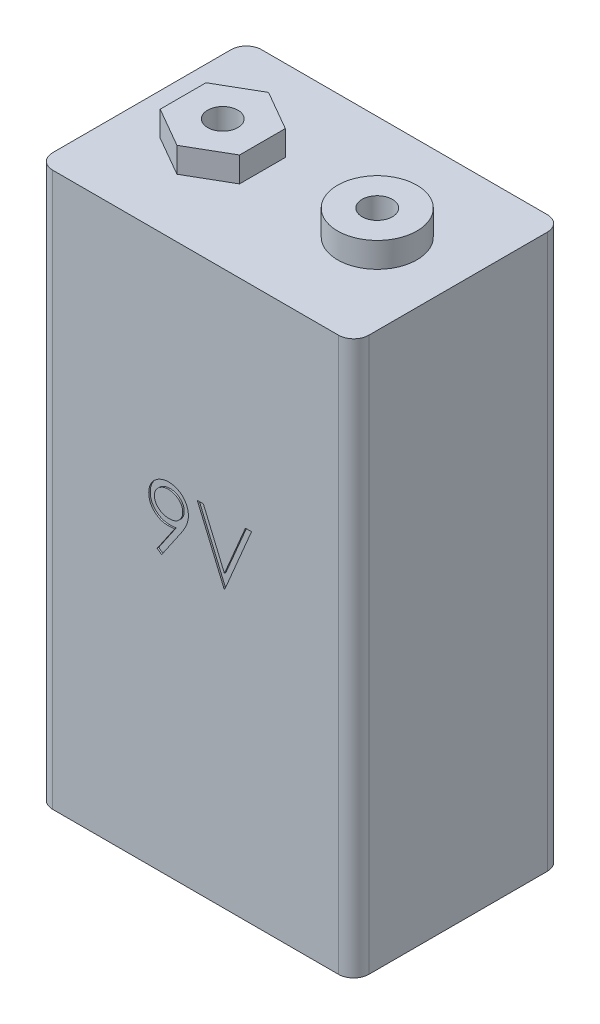
from build123d import *

# Parameters (mm, degrees)
SKETCH1_W           = 26.5
SKETCH1_H           = 46.4
BOSS_EXTRUDE1_DEPTH = 8.75
SKETCH2_R           = 3.325
SKETCH2_R_2         = 1.27
BOSS_EXTRUDE2_DEPTH = 2.1
CUT_EXTRUDE1_DEPTH  = 0.127
FILLET1_R           = 1.27


with BuildPart() as part:
    # Sketch1 → Boss-Extrude1 (new, symmetric)
    with BuildSketch(Plane.XY):
        Rectangle(SKETCH1_W, SKETCH1_H)
    extrude(amount=BOSS_EXTRUDE1_DEPTH, both=True)

    # Sketch2 → Boss-Extrude2 (add)
    # profile 1 of 2: a face of its own
    with BuildSketch(Plane(origin=(0, 23.2, 0), x_dir=(1, 0, 0), z_dir=(0, 1, 0))):
        with Locations(Location((6.475, 0, 0), (0, 0, 90))):
            Circle(SKETCH2_R)
        with Locations(Location((6.475, 0, 0), (0, 0, 270))):
            Circle(SKETCH2_R_2, mode=Mode.SUBTRACT)
    # profile 2 of 2: a face of its own
    with BuildSketch(Plane(origin=(0, 23.2, 0), x_dir=(1, 0, 0), z_dir=(0, 1, 0))):
        Polygon((-6.475, 3.83937929), (-9.8, 1.919689645), (-9.8, -1.919689645), (-6.475, -3.83937929), (-3.15, -1.919689645), (-3.15, 1.919689645), align=None)
        with Locations(Location((-6.475, 0, 0), (0, 0, 270))):
            Circle(SKETCH2_R_2, mode=Mode.SUBTRACT)
    extrude(amount=BOSS_EXTRUDE2_DEPTH)

    # Sketch3 → Cut-Extrude1 (cut)
    # profile 1 of 2: a face of its own
    with BuildSketch(Plane.XY.offset(8.75)):
        with BuildLine():
            Line((-2.843132665, -0.135683761), (-3.222623183, 0.128263555))
            Line((-3.222623183, 0.128263555), (-1.751302403, 2.279063168))
            add(Edge.make_bspline(
                [(-1.751302403, 2.279063168), (-1.845177682, 2.267583179), (-2.03002334, 2.244978442), (-2.216194911, 2.240825761), (-2.307817828, 2.238782051)],
                knots=[0, 0, 0, 0, 1.015715272, 2, 2, 2, 2], degree=3))
            add(Edge.make_bspline(
                [(-2.307817828, 2.238782051), (-2.363368305, 2.240204869), (-2.472409033, 2.242997737), (-2.632718794, 2.265134756), (-2.786760058, 2.299228402), (-2.934124441, 2.350102115), (-3.075365836, 2.413327264), (-3.210175902, 2.49173013), (-3.338373165, 2.583965833), (-3.458580797, 2.689546665), (-3.567909259, 2.805476578), (-3.66531115, 2.928176181), (-3.746260242, 3.059070803), (-3.813504604, 3.195490302), (-3.864501837, 3.339395439), (-3.901638055, 3.489148699), (-3.924501614, 3.645799634), (-3.927221675, 3.752426915), (-3.92860275, 3.806565505)],
                knots=[0, 0, 0, 0, 1.060718605, 2.082097864, 3.085795603, 4.069760067, 5.054557537, 6.03741023, 7.043284206, 8.066802108, 9.088538119, 10.083643548, 11.053783639, 12.022749082, 12.983451788, 13.964007469, 14.966251758, 16, 16, 16, 16], degree=3))
            add(Edge.make_bspline(
                [(-3.92860275, 3.806565505), (-3.92598045, 3.880601444), (-3.920833407, 4.025918974), (-3.879409458, 4.238241458), (-3.811282517, 4.439002066), (-3.716291995, 4.627672954), (-3.596647832, 4.801540095), (-3.452852702, 4.958186445), (-3.285781232, 5.095384022), (-3.09923937, 5.213318758), (-2.897622303, 5.308168099), (-2.686456594, 5.378077517), (-2.467360245, 5.419199434), (-2.318940077, 5.424620914), (-2.244216065, 5.427350427)],
                knots=[0, 0, 0, 0, 1.022988612, 2.007919123, 2.978103895, 3.94594894, 4.918897164, 5.887013414, 6.875921846, 7.89917871, 8.930658928, 9.948724884, 10.967259574, 12, 12, 12, 12], degree=3))
            add(Edge.make_bspline(
                [(-2.244216065, 5.427350427), (-2.170906192, 5.424583395), (-2.026052794, 5.419116), (-1.813042034, 5.379074761), (-1.609024068, 5.311588363), (-1.415129862, 5.218327177), (-1.235607179, 5.101425329), (-1.074172322, 4.962126704), (-0.934509305, 4.800344538), (-0.816847009, 4.619991701), (-0.722398257, 4.426215432), (-0.654253258, 4.223946883), (-0.612304494, 4.014640721), (-0.607018381, 3.872832409), (-0.604350614, 3.801265358)],
                knots=[0, 0, 0, 0, 1.026385292, 2.028040595, 3.023318987, 4.028184125, 5.03290303, 6.015178782, 7.004435299, 8.016004309, 9.023023918, 10.015172535, 10.998308025, 12, 12, 12, 12], degree=3))
            add(Edge.make_bspline(
                [(-0.604350614, 3.801265358), (-0.606132256, 3.745712281), (-0.609745871, 3.633036762), (-0.635049573, 3.461843267), (-0.678018187, 3.287292003), (-0.726779683, 3.139546257), (-0.773848556, 3.017522768), (-0.818149077, 2.921136451), (-0.867304356, 2.819685731), (-0.924633918, 2.714234399), (-0.986262629, 2.603438185), (-1.055899868, 2.488408365), (-1.131957102, 2.368990578), (-1.186128226, 2.288486052), (-1.213867507, 2.247262286)],
                knots=[0, 0, 0, 0, 1.179839688, 2.393009684, 3.667231171, 4.993948276, 5.694988576, 6.444077775, 7.246288328, 8.089075292, 8.993003841, 9.939041771, 10.944649915, 12, 12, 12, 12], degree=3))
            Line((-1.213867507, 2.247262286), (-2.843132665, -0.135683761))
        make_face()
        with BuildLine():
            add(Edge.make_bspline(
                [(-2.219835389, 2.781517094), (-2.177753011, 2.782666722), (-2.095832926, 2.784904656), (-1.97582201, 2.798525772), (-1.86254375, 2.822676918), (-1.755695551, 2.85732934), (-1.654206069, 2.899143589), (-1.559687334, 2.952380758), (-1.472060244, 3.015905909), (-1.390738021, 3.087282956), (-1.318523403, 3.166583243), (-1.254202392, 3.24958244), (-1.199531058, 3.336644886), (-1.156346103, 3.42886089), (-1.120839662, 3.523985717), (-1.096319572, 3.62355123), (-1.082736116, 3.727038693), (-1.080420521, 3.797340236), (-1.079243776, 3.833066239)],
                knots=[0, 0, 0, 0, 1.163407946, 2.26475976, 3.333800367, 4.359385343, 5.366239384, 6.363380779, 7.350133999, 8.353570782, 9.349036268, 10.310270964, 11.253520213, 12.184142, 13.120487599, 14.056272588, 15.012232024, 16, 16, 16, 16], degree=3))
            add(Edge.make_bspline(
                [(-1.079243776, 3.833066239), (-1.080256252, 3.868807162), (-1.08225146, 3.939239033), (-1.098258449, 4.042879712), (-1.126418012, 4.142201665), (-1.164201245, 4.237748649), (-1.21397351, 4.32873564), (-1.273699018, 4.41630497), (-1.344656412, 4.499901401), (-1.426303149, 4.577558852), (-1.514348247, 4.649144366), (-1.608177813, 4.712320934), (-1.70701846, 4.765269647), (-1.810267177, 4.808962137), (-1.918139085, 4.843058274), (-2.030570353, 4.867577385), (-2.148129121, 4.881141824), (-2.227929399, 4.883442783), (-2.268596741, 4.884615385)],
                knots=[0, 0, 0, 0, 0.972161553, 1.915763587, 2.844109794, 3.775983486, 4.705125789, 5.659731448, 6.655561913, 7.682237399, 8.721216875, 9.739758359, 10.754845918, 11.767244016, 12.7857855, 13.828538656, 14.893392813, 16, 16, 16, 16], degree=3))
            add(Edge.make_bspline(
                [(-2.268596741, 4.884615385), (-2.308910401, 4.883440889), (-2.388005471, 4.881136539), (-2.50451914, 4.867603169), (-2.616190192, 4.842893377), (-2.723749546, 4.808977931), (-2.826995195, 4.765266388), (-2.92583118, 4.712318159), (-3.019682694, 4.649158909), (-3.107643379, 4.577502527), (-3.189434285, 4.500262871), (-3.259171692, 4.415938759), (-3.319033886, 4.328781192), (-3.368737759, 4.237736543), (-3.406539184, 4.142204896), (-3.434693877, 4.042878836), (-3.450702174, 3.939239261), (-3.452697203, 3.868807239), (-3.453709588, 3.833066239)],
                knots=[0, 0, 0, 0, 1.099389452, 2.15699305, 3.192601482, 4.213358962, 5.227959689, 6.245255729, 7.266013209, 8.307253147, 9.336162325, 10.327954924, 11.284637477, 12.215801273, 13.149702402, 14.080068371, 15.025723358, 16, 16, 16, 16], degree=3))
            add(Edge.make_bspline(
                [(-3.453709588, 3.833066239), (-3.452793485, 3.797312415), (-3.450986763, 3.72679933), (-3.433557843, 3.62319395), (-3.40441092, 3.523879657), (-3.365374461, 3.427890778), (-3.313967294, 3.336160707), (-3.25088481, 3.249124338), (-3.176944282, 3.165795027), (-3.093134128, 3.087467456), (-3.001409647, 3.015573096), (-2.903443138, 2.952783113), (-2.800921122, 2.899756918), (-2.693482704, 2.857209825), (-2.58192409, 2.823023144), (-2.465242642, 2.798570284), (-2.343824235, 2.785035309), (-2.261561524, 2.782701084), (-2.219835389, 2.781517094)],
                knots=[0, 0, 0, 0, 0.952633368, 1.87876736, 2.791047057, 3.707742249, 4.635551637, 5.587206343, 6.568248508, 7.601284464, 8.641511608, 9.671105535, 10.699146789, 11.713763218, 12.747829548, 13.806491675, 14.887386225, 16, 16, 16, 16], degree=3))
        make_face(mode=Mode.SUBTRACT)
    # profile 2 of 2: a face of its own
    with BuildSketch(Plane.XY.offset(8.75)):
        Polygon((0.14191007, 5.291666667), (0.650724173, 5.291666667), (2.413553032, 1.124691173), (4.177441921, 5.291666667), (4.687316053, 5.291666667), (2.448534002, 0), (2.380692122, 0), align=None)
    extrude(amount=-CUT_EXTRUDE1_DEPTH, mode=Mode.SUBTRACT)

    # Fillet1
    fillet1_edges = [part.edges().sort_by_distance(p)[0] for p in [
        (-13.25, 0, 8.75),
        (13.25, 0, 8.75),
        (-13.25, 0, -8.75),
        (13.25, 0, -8.75),
    ]]
    fillet(fillet1_edges, radius=FILLET1_R)


solid = part.part
